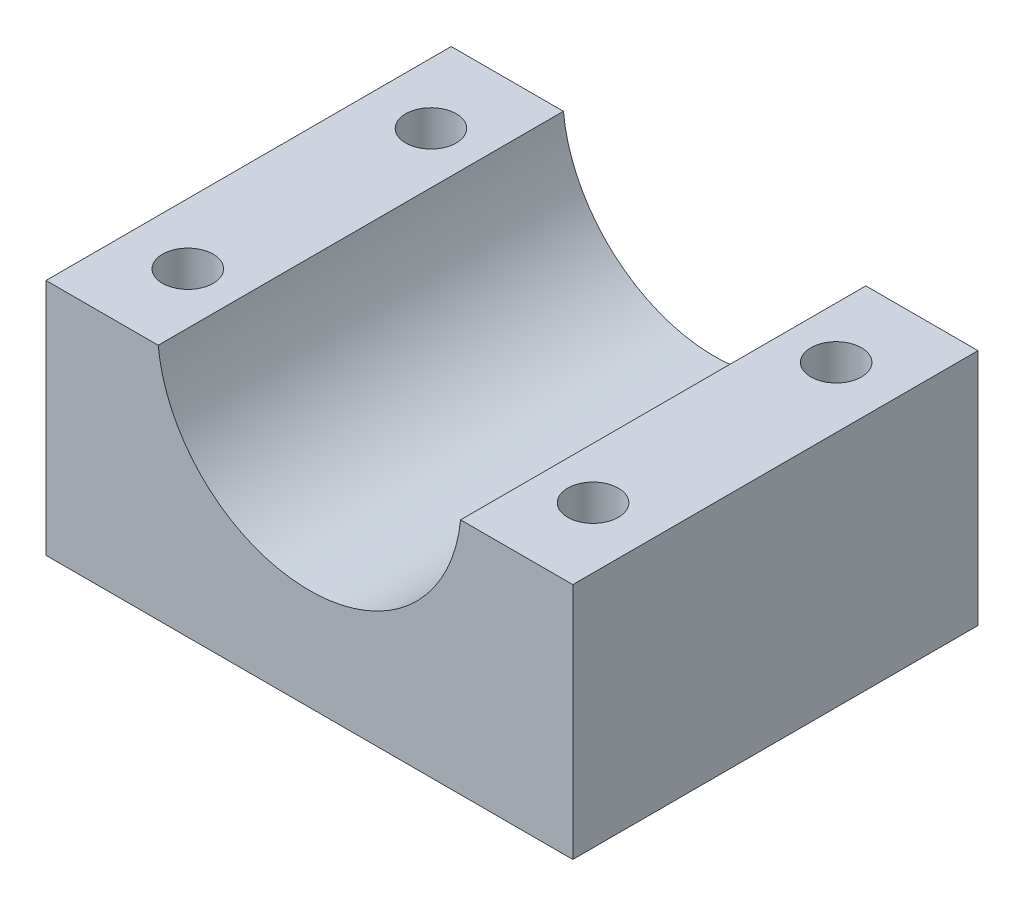
from build123d import *

# Parameters (mm, degrees)
BOSS_EXTRUDE1_DEPTH = 40
SKETCH2_R           = 2.5
CUT_EXTRUDE1_DEPTH  = 23.5


with BuildPart() as part:
    # Sketch1 → Boss-Extrude1 (new body)
    with BuildSketch(Plane.XY):
        with BuildLine():
            Line((0, 23.5), (0, 0))
            Line((0, 0), (52, 0))
            Line((52, 0), (52, 23.5))
            Line((52, 23.5), (40.924811557, 23.5))
            ThreePointArc((40.924811557, 23.5), (26, 10), (11.075188443, 23.5))
            Line((11.075188443, 23.5), (0, 23.5))
        make_face()
    extrude(amount=BOSS_EXTRUDE1_DEPTH)

    # Sketch2 → Cut-Extrude1 (cut)
    with BuildSketch(Plane(origin=(0, 0, 0), x_dir=(-1, 0, 0), z_dir=(0, -1, 0))):
        with Locations(Location((-6, -8, 0), (0, 0, 90))):
            Circle(SKETCH2_R)
        with Locations(Location((-6, -32, 0), (0, 0, 90))):
            Circle(SKETCH2_R)
        with Locations(Location((-46, -32, 0), (0, 0, 90))):
            Circle(SKETCH2_R)
        with Locations(Location((-46, -8, 0), (0, 0, 90))):
            Circle(SKETCH2_R)
    extrude(amount=-CUT_EXTRUDE1_DEPTH, mode=Mode.SUBTRACT)


solid = part.part
